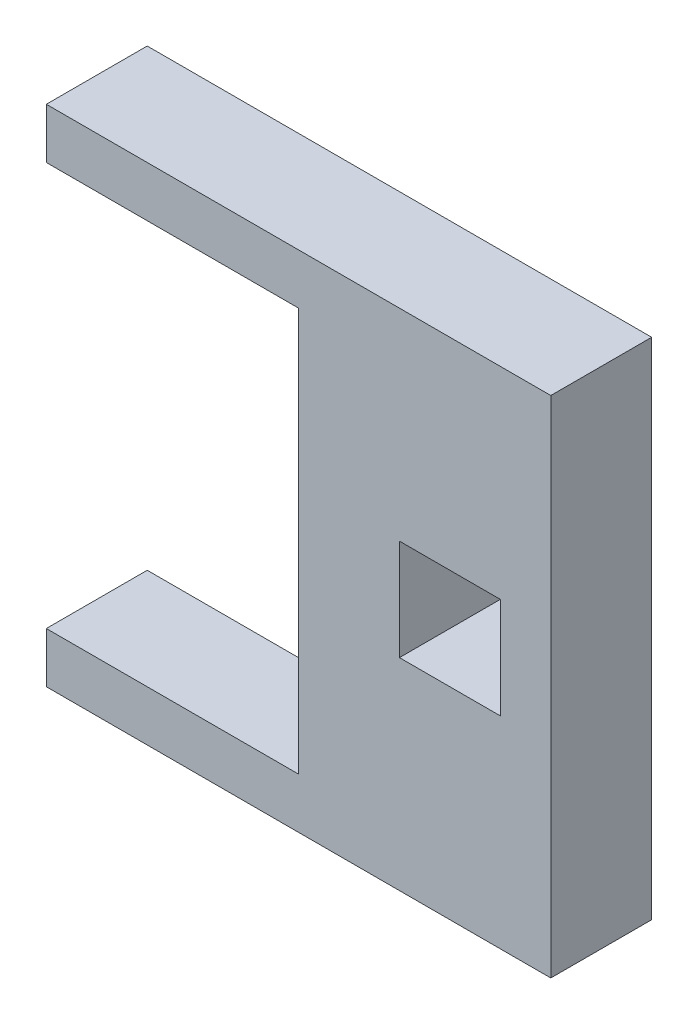
from build123d import *

# Parameters (mm, degrees)
SKETCH1_W           = 10
SKETCH1_H           = 10
BOSS_EXTRUDE1_DEPTH = 10


with BuildPart() as part:
    # Sketch1 → Boss-Extrude1 (new body)
    with BuildSketch(Plane.XY):
        Polygon((0, 45), (25, 45), (25, 5), (0, 5), (0, 0), (50, 0), (50, 50), (0, 50), align=None)
        with Locations((40, 25)):
            Rectangle(SKETCH1_W, SKETCH1_H, mode=Mode.SUBTRACT)
    extrude(amount=BOSS_EXTRUDE1_DEPTH)


solid = part.part
